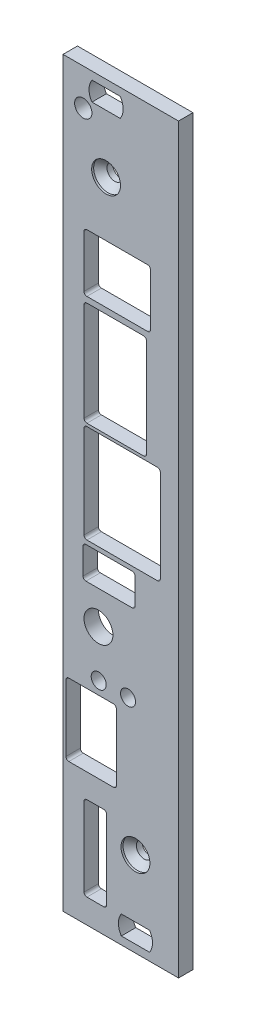
from build123d import *

# Parameters (mm, degrees)
SKETCH1_W                                      = 19.98
SKETCH1_H                                      = 128.4
BOSS_EXTRUDE1_DEPTH                            = 2.5
CUT_EXTRUDE1_DEPTH                             = 127.049239982
CUT_EXTRUDE2_DEPTH                             = 127.049239982
SKETCH4_W                                      = 3.9
SKETCH4_H                                      = 14.6
CUT_EXTRUDE3_DEPTH                             = 127.049239982
F_3_0_3_DIAMETER_HOLE1_D                       = 3
CSK_FOR_M2_5_FLAT_HEAD_MACHINE_SCREW1_AT_COUNT = 2
CSK_FOR_M2_5_FLAT_HEAD_MACHINE_SCREW1_AT_PITCH = 99.130249672
USB_DEPTH                                      = 127.049239982
SKETCH10_R                                     = 1.3
LEDS_DEPTH                                     = 127.049239982
SKETCH11_R                                     = 2.5
RESET_SWITCH_DEPTH                             = 127.049239982
SKETCH13_W                                     = 9
SKETCH13_H                                     = 5.5
DISABLE_COMMS_DEPTH                            = 127.049239982
SKETCH14_W                                     = 13.2
SKETCH14_H                                     = 17
RJ45_DEPTH                                     = 127.049239982
SKETCH15_W                                     = 10.8
SKETCH15_H                                     = 18
OUTPUT_DEPTH                                   = 127.049239982
SKETCH16_W                                     = 11.5
SKETCH16_H                                     = 10
POWER_DEPTH                                    = 127.049239982
FILLETS_R                                      = 0.5


with BuildPart() as part:
    # Sketch1 → Boss-Extrude1 (new body)
    with BuildSketch(Plane.XY.offset(2.5)):
        with Locations((2.54, 61.2)):
            Rectangle(SKETCH1_W, SKETCH1_H)
    extrude(amount=-BOSS_EXTRUDE1_DEPTH)

    # Sketch2 → Cut-Extrude1 (cut, through all)
    with BuildSketch(Plane.XY.offset(2.5)):
        with BuildLine():
            Line((2.445403852, 124.05), (-2.445403852, 124.05))
            ThreePointArc((-2.445403852, 124.05), (-2.95, 122.4), (-2.445403852, 120.75))
            Line((-2.445403852, 120.75), (2.445403852, 120.75))
            ThreePointArc((2.445403852, 120.75), (2.95, 122.4), (2.445403852, 124.05))
        make_face()
    extrude(amount=-CUT_EXTRUDE1_DEPTH, mode=Mode.SUBTRACT)

    # Sketch3 → Cut-Extrude2 (cut, through all)
    with BuildSketch(Plane.XY.offset(2.5)):
        with BuildLine():
            Line((7.525403852, 1.65), (2.634596148, 1.65))
            ThreePointArc((2.634596148, 1.65), (2.13, 0), (2.634596148, -1.65))
            Line((2.634596148, -1.65), (7.525403852, -1.65))
            ThreePointArc((7.525403852, -1.65), (8.03, 0), (7.525403852, 1.65))
        make_face()
    extrude(amount=-CUT_EXTRUDE2_DEPTH, mode=Mode.SUBTRACT)

    # Sketch4 → Cut-Extrude3 (cut, through all)
    with BuildSketch(Plane(origin=(0, 0, 0), x_dir=(-1, 0, 0), z_dir=(0, 0, -1))):
        with Locations((1.87, 8.5)):
            Rectangle(SKETCH4_W, SKETCH4_H)
    extrude(amount=-CUT_EXTRUDE3_DEPTH, mode=Mode.SUBTRACT)

    # Ø3.0 (3) Diameter Hole1 (through all)
    with Locations(Plane.XY.offset(2.5)):
        with Locations((-3.95, 119.1)):
            Hole(F_3_0_3_DIAMETER_HOLE1_D / 2)

    # Sketch7 → CSK for M2.5 Flat Head Machine Screw1 (revolve, cut)
    with BuildSketch(Plane(origin=(5.08, 11.7, 2.5), x_dir=(0, -1, 0), z_dir=(1, 0, 0))):
        Polygon((0, 0), (0, 2.5), (1.35, 2.5), (1.35, 1.5), (2.5, 0.35), (2.5, 0), align=None)
    csk_for_m2_5_flat_head_machine_screw1 = revolve(axis=Axis((5.08, 11.7, 8.85), (0, 0, -1)), mode=Mode.SUBTRACT)

    # CSK for M2.5 Flat Head Machine Screw1 at: CSK for M2.5 Flat Head Machine Screw1 ×2
    with Locations(*[Vector(-0.05124570972853528, 0.9986860754183062, 0) * (i * CSK_FOR_M2_5_FLAT_HEAD_MACHINE_SCREW1_AT_PITCH) for i in range(1, CSK_FOR_M2_5_FLAT_HEAD_MACHINE_SCREW1_AT_COUNT)]):
        add(csk_for_m2_5_flat_head_machine_screw1, mode=Mode.SUBTRACT)

    # Sketch9 → USB (cut, through all)
    with BuildSketch(Plane.XY.offset(2.5)):
        Polygon((-3.82, 19.95), (1.78, 19.95), (1.78, 32.45), (-3.82, 32.45), (-6.95, 32.45), (-6.95, 19.95), align=None)
    extrude(amount=-USB_DEPTH, mode=Mode.SUBTRACT)

    # Sketch10 → LEDs (cut, through all)
    with BuildSketch(Plane.XY.offset(2.5)):
        with Locations((-1.28, 34.65)):
            Circle(SKETCH10_R)
        with Locations((3.8, 34.65)):
            Circle(SKETCH10_R)
    extrude(amount=-LEDS_DEPTH, mode=Mode.SUBTRACT)

    # Sketch11 → Reset switch (cut, through all)
    with BuildSketch(Plane.XY.offset(2.5)):
        with Locations((-1.32, 42.7)):
            Circle(SKETCH11_R)
    extrude(amount=-RESET_SWITCH_DEPTH, mode=Mode.SUBTRACT)

    # Sketch13 → Disable comms (cut, through all)
    with BuildSketch(Plane.XY.offset(2.5)):
        with Locations((0.505, 51.2)):
            Rectangle(SKETCH13_W, SKETCH13_H)
    extrude(amount=-DISABLE_COMMS_DEPTH, mode=Mode.SUBTRACT)

    # Sketch14 → RJ45 (cut, through all)
    with BuildSketch(Plane.XY.offset(2.5)):
        with Locations((2.78, 63.2)):
            Rectangle(SKETCH14_W, SKETCH14_H)
    extrude(amount=-RJ45_DEPTH, mode=Mode.SUBTRACT)

    # Sketch15 → Output (cut, through all)
    with BuildSketch(Plane.XY.offset(2.5)):
        with Locations((1.58, 81.2)):
            Rectangle(SKETCH15_W, SKETCH15_H)
    extrude(amount=-OUTPUT_DEPTH, mode=Mode.SUBTRACT)

    # Sketch16 → Power (cut, through all)
    with BuildSketch(Plane.XY.offset(2.5)):
        with Locations((1.93, 96.2)):
            Rectangle(SKETCH16_W, SKETCH16_H)
    extrude(amount=-POWER_DEPTH, mode=Mode.SUBTRACT)

    # Fillets
    fillets_edges = [part.edges().sort_by_distance(p)[0] for p in [
        (5.005, 53.95, 1.25),
        (5.005, 48.45, 1.25),
        (-3.995, 48.45, 1.25),
        (-3.995, 53.95, 1.25),
        (9.38, 54.7, 1.25),
        (-3.82, 54.7, 1.25),
        (-3.82, 71.7, 1.25),
        (9.38, 71.7, 1.25),
        (6.98, 72.2, 1.25),
        (-3.82, 72.2, 1.25),
        (-3.82, 90.2, 1.25),
        (6.98, 90.2, 1.25),
        (7.68, 91.2, 1.25),
        (-3.82, 91.2, 1.25),
        (-3.82, 101.2, 1.25),
        (7.68, 101.2, 1.25),
        (-3.82, 15.8, 1.25),
        (-3.82, 1.2, 1.25),
        (0.08, 1.2, 1.25),
        (0.08, 15.8, 1.25),
        (-6.95, 19.95, 1.25),
        (-6.95, 32.45, 1.25),
        (1.78, 32.45, 1.25),
        (1.78, 19.95, 1.25),
    ]]
    fillet(fillets_edges, radius=FILLETS_R)


solid = part.part
